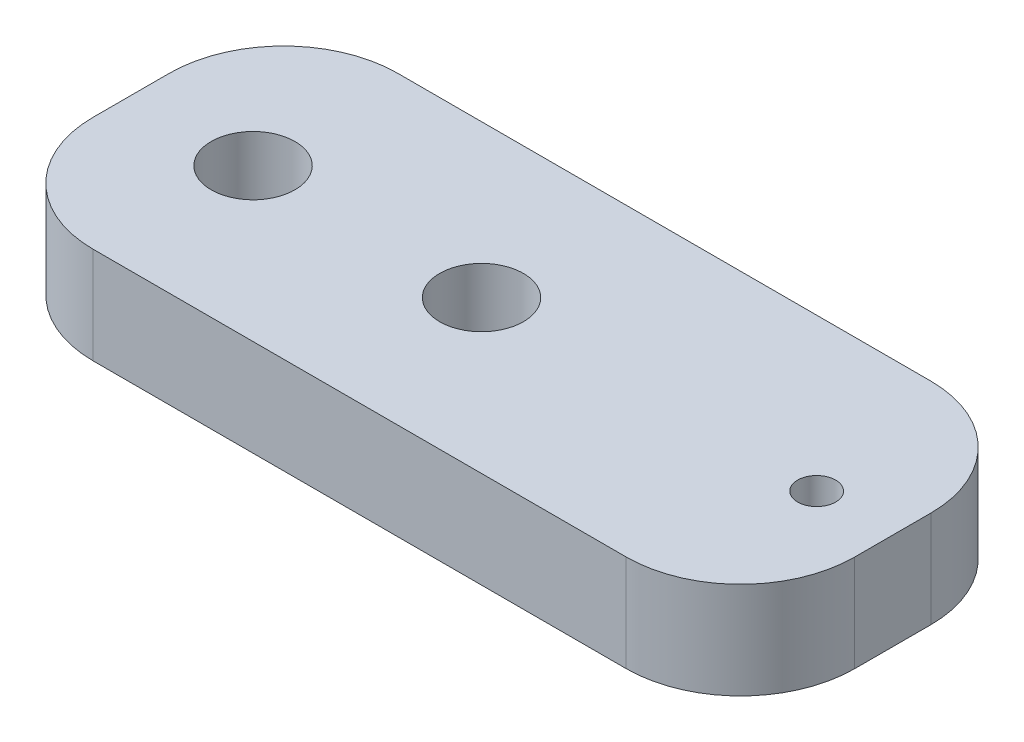
from build123d import *

# Parameters (mm, degrees)
SKETCH2_W                       = 50
SKETCH2_H                       = 20
BOSS_EXTRUDE1_DEPTH             = 6.35
M5_CLEARANCE_HOLE1_D            = 5.5
TAP_DRILL_FOR_M3X0_5_TAP1_D     = 2.5
TAP_DRILL_FOR_M3X0_5_TAP1_DEPTH = 6.35
TAP_DRILL_FOR_M3X0_5_TAP1_TIP   = 0.751075774
FILLET1_R                       = 7.5


with BuildPart() as part:
    # Sketch2 → Boss-Extrude1 (new body)
    with BuildSketch(Plane(origin=(0, 0, 0), x_dir=(1, 0, 0), z_dir=(0, 1, 0))):
        with Locations((25, 10)):
            Rectangle(SKETCH2_W, SKETCH2_H)
    extrude(amount=BOSS_EXTRUDE1_DEPTH)

    # M5 Clearance Hole1 (through all)
    with Locations(Plane(origin=(8, 6.35, -10), x_dir=(0, 0, 1), z_dir=(0, 1, 0))):
        with Locations((0, 0), (0, 15)):
            Hole(M5_CLEARANCE_HOLE1_D / 2)

    # Tap Drill for M3x0.5 Tap1
    with Locations(Plane(origin=(45, 6.35, -10), x_dir=(0, 0, 1), z_dir=(0, 1, 0))):
        with Locations((0, 0)):
            Hole(TAP_DRILL_FOR_M3X0_5_TAP1_D / 2, depth=TAP_DRILL_FOR_M3X0_5_TAP1_DEPTH)
            with Locations((0, 0, -(TAP_DRILL_FOR_M3X0_5_TAP1_DEPTH + TAP_DRILL_FOR_M3X0_5_TAP1_TIP / 2))):  # 118° drill point
                Cone(0, TAP_DRILL_FOR_M3X0_5_TAP1_D / 2, TAP_DRILL_FOR_M3X0_5_TAP1_TIP, mode=Mode.SUBTRACT)

    # Fillet1
    fillet1_edges = [part.edges().sort_by_distance(p)[0] for p in [
        (0, 3.175, -20),
        (50, 3.175, -20),
        (50, 3.175, 0),
        (0, 3.175, 0),
    ]]
    fillet(fillet1_edges, radius=FILLET1_R)


solid = part.part
